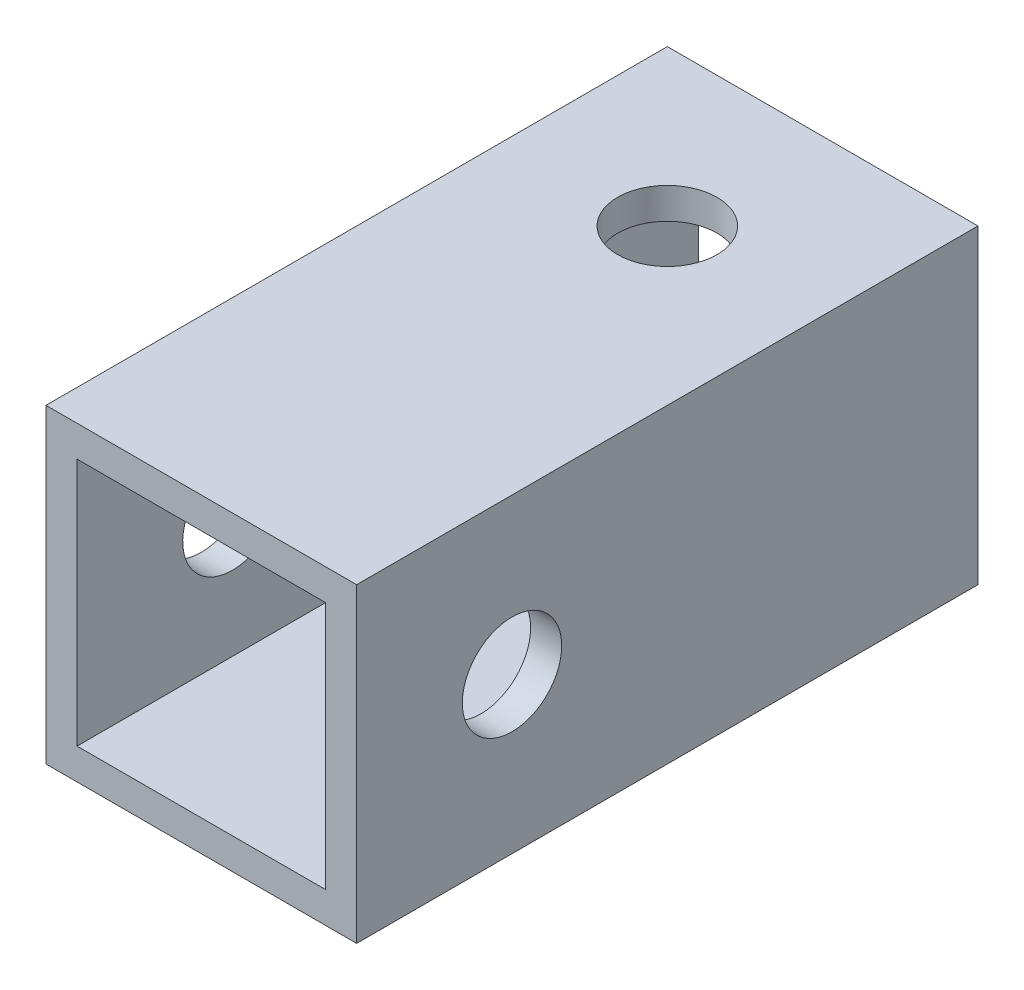
from build123d import *

# Parameters (mm, degrees)
SKETCH_1_W          = 10
SKETCH_1_H          = 10
SKETCH_1_W_2        = 8
SKETCH_1_H_2        = 8
EXTRUDE_1_DEPTH     = 20
SKETCH_3_R          = 1.6
CUT_EXTRUDE_1_DEPTH = 23.912878475
SKETCH_4_R          = 1.6
CUT_EXTRUDE_2_DEPTH = 23.912878475


with BuildPart() as part:
    # ｽｹｯﾁ1 → ﾎﾞｽ - 押し出し1 (new body)
    with BuildSketch(Plane.XY):
        Rectangle(SKETCH_1_W, SKETCH_1_H)
        Rectangle(SKETCH_1_W_2, SKETCH_1_H_2, mode=Mode.SUBTRACT)
    extrude(amount=EXTRUDE_1_DEPTH)

    # ｽｹｯﾁ3 → ｶｯﾄ - 押し出し1 (cut, through all)
    with BuildSketch(Plane(origin=(0, 5, 0), x_dir=(1, 0, 0), z_dir=(0, 1, 0))):
        with Locations(Location((0, -5, 0), (0, 0, 270))):
            Circle(SKETCH_3_R)
    extrude(amount=-CUT_EXTRUDE_1_DEPTH, mode=Mode.SUBTRACT)

    # ｽｹｯﾁ4 → ｶｯﾄ - 押し出し2 (cut, through all)
    with BuildSketch(Plane.ZY.offset(5)):
        with Locations(Location((15, 0, 0), (0, 0, 270))):
            Circle(SKETCH_4_R)
    extrude(amount=-CUT_EXTRUDE_2_DEPTH, mode=Mode.SUBTRACT)


solid = part.part
